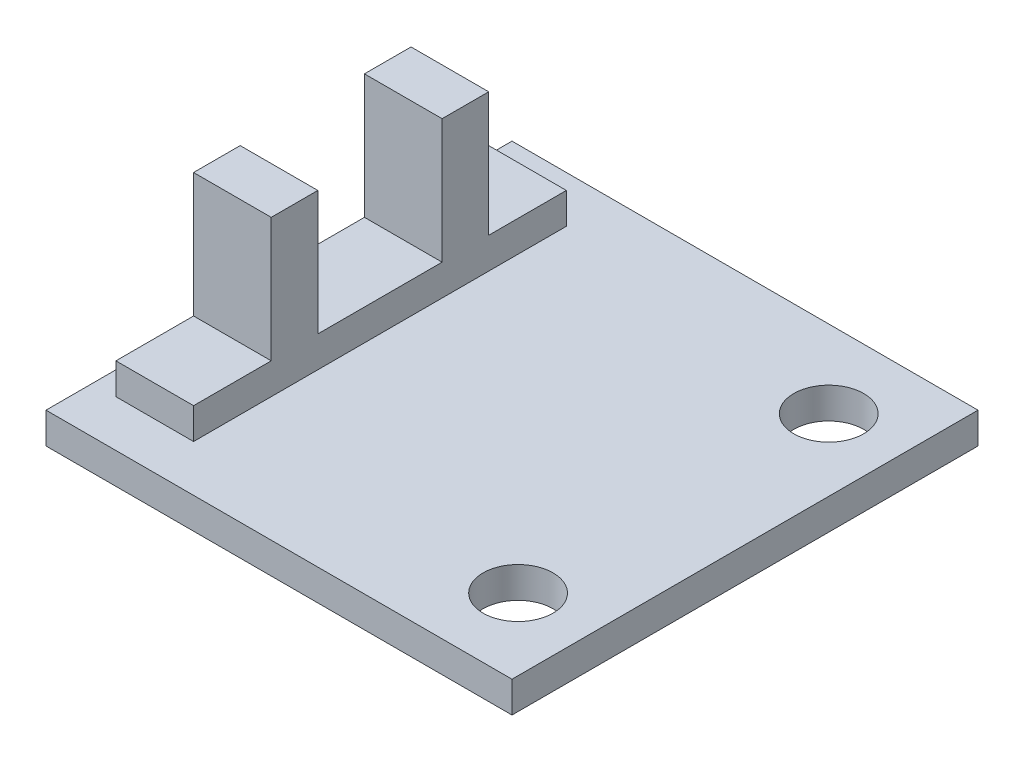
from build123d import *

# Parameters (mm, degrees)
SKETCH1_W           = 30
SKETCH1_H           = 30
BOSS_EXTRUDE1_DEPTH = 2
SKETCH2_W           = 5
SKETCH2_H           = 24
BOSS_EXTRUDE2_DEPTH = 10
SKETCH3_W           = 5
SKETCH3_H           = 5
SKETCH3_H_2         = 8
CUT_EXTRUDE1_DEPTH  = 8
SKETCH4_R           = 2.25
CUT_EXTRUDE2_DEPTH  = 10


with BuildPart() as part:
    # Sketch1 → Boss-Extrude1 (new body)
    with BuildSketch(Plane(origin=(0, 0, 0), x_dir=(1, 0, 0), z_dir=(0, 1, 0))):
        with Locations((15, 15)):
            Rectangle(SKETCH1_W, SKETCH1_H)
    extrude(amount=BOSS_EXTRUDE1_DEPTH)

    # Sketch2 → Boss-Extrude2 (add)
    with BuildSketch(Plane(origin=(0, 2, 0), x_dir=(1, 0, 0), z_dir=(0, 1, 0))):
        with Locations((4, 15)):
            Rectangle(SKETCH2_W, SKETCH2_H)
    extrude(amount=BOSS_EXTRUDE2_DEPTH)

    # Sketch3 → Cut-Extrude1 (cut)
    with BuildSketch(Plane(origin=(0, 12, 0), x_dir=(1, 0, 0), z_dir=(0, 1, 0))):
        with Locations((4, 24.5)):
            Rectangle(SKETCH3_W, SKETCH3_H)
        with Locations((4, 5.5)):
            Rectangle(SKETCH3_W, SKETCH3_H)
        with Locations((4, 15)):
            Rectangle(SKETCH3_W, SKETCH3_H_2)
    extrude(amount=-CUT_EXTRUDE1_DEPTH, mode=Mode.SUBTRACT)

    # Sketch4 → Cut-Extrude2 (cut)
    with BuildSketch(Plane.XZ):
        with Locations(Location((25.390935128, -5, 0), (0, 0, 270))):
            Circle(SKETCH4_R)
        with Locations(Location((25.390935128, -25, 0), (0, 0, 270))):
            Circle(SKETCH4_R)
    extrude(amount=-CUT_EXTRUDE2_DEPTH, mode=Mode.SUBTRACT)


solid = part.part
